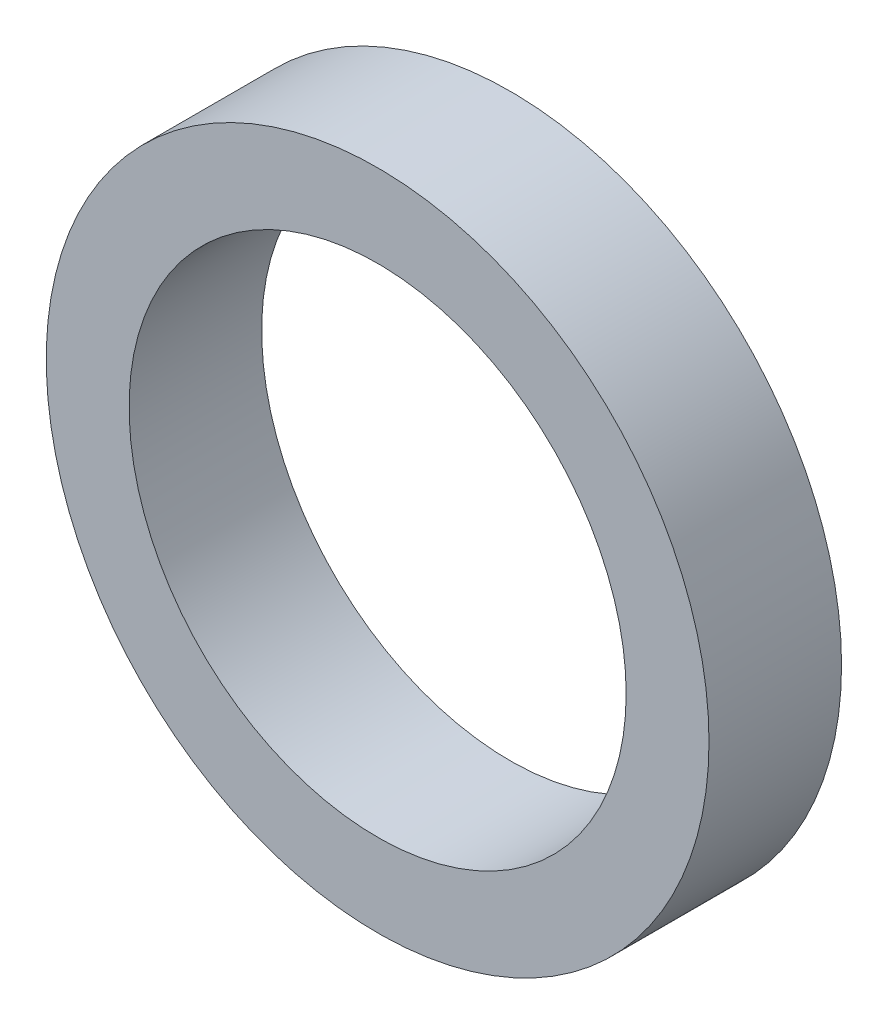
from build123d import *

# Parameters (mm, degrees)
SKETCH2_R           = 12.7
SKETCH2_R_2         = 9.525
BOSS_EXTRUDE1_DEPTH = 5.08


with BuildPart() as part:
    # Sketch2 → Boss-Extrude1 (new body)
    with BuildSketch(Plane.XY):
        Circle(SKETCH2_R)
        Circle(SKETCH2_R_2, mode=Mode.SUBTRACT)
    extrude(amount=BOSS_EXTRUDE1_DEPTH)


solid = part.part
